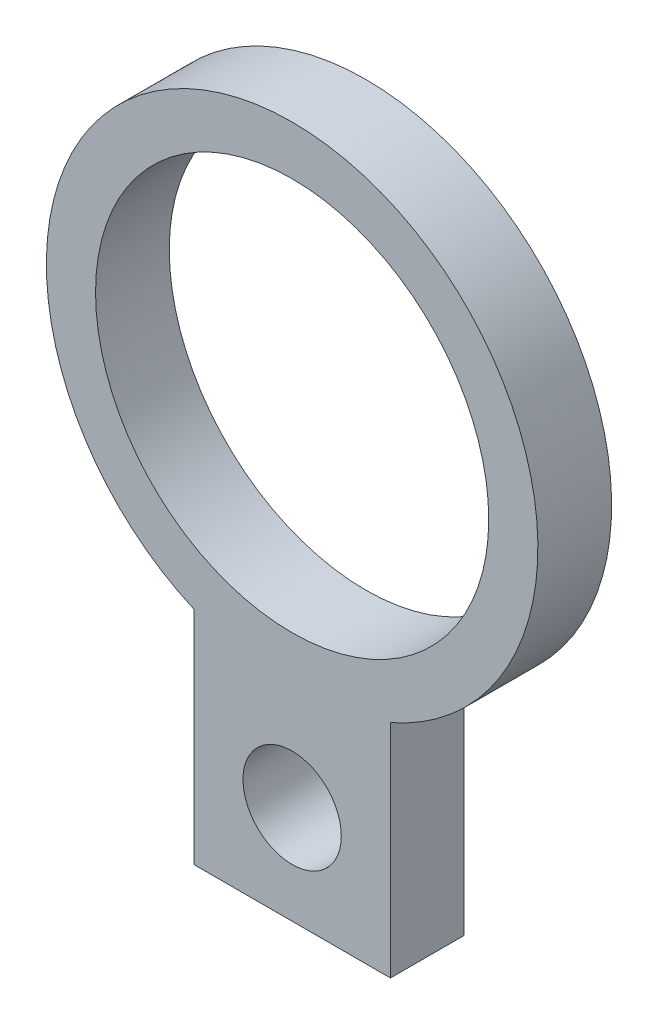
from build123d import *

# Parameters (mm, degrees)
SKETCH_1_R      = 1
SKETCH_1_R_2    = 4
EXTRUDE_1_DEPTH = 1.5


with BuildPart() as part:
    # 草图1 → 凸台-拉伸1 (new body)
    with BuildSketch(Plane.XY):
        with BuildLine():
            Line((-2, -9.082575695), (2, -9.082575695))
            Line((2, -9.082575695), (2, -4.582575695))
            ThreePointArc((2, -4.582575695), (0, 5), (-2, -4.582575695))
            Line((-2, -4.582575695), (-2, -9.082575695))
        make_face()
        with Locations((0, -7.082575695)):
            Circle(SKETCH_1_R, mode=Mode.SUBTRACT)
        Circle(SKETCH_1_R_2, mode=Mode.SUBTRACT)
    extrude(amount=EXTRUDE_1_DEPTH)


solid = part.part
